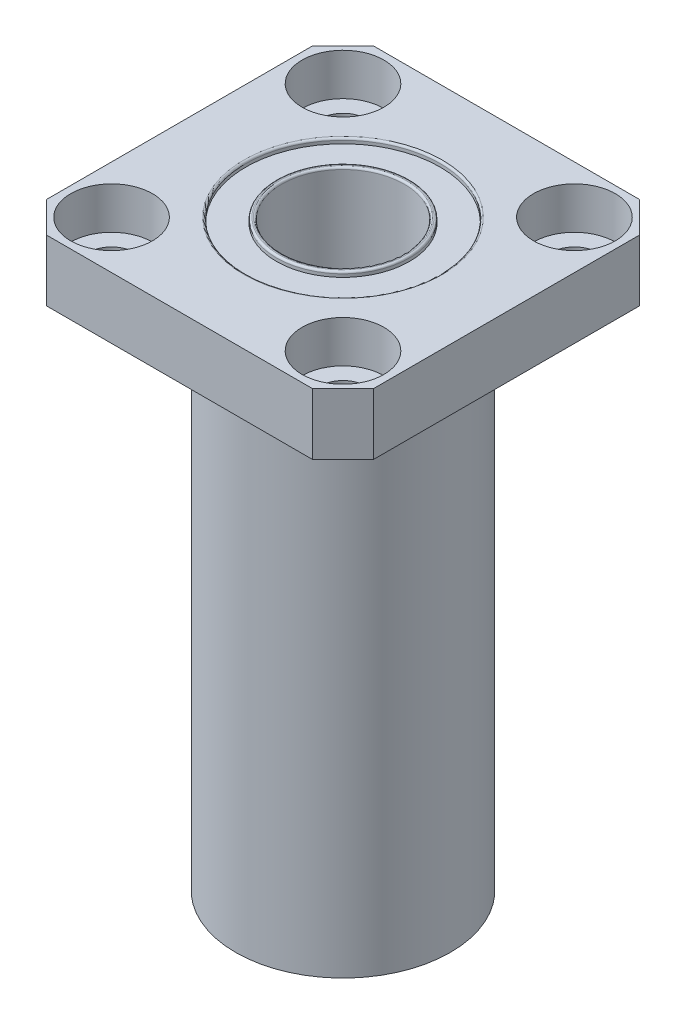
from build123d import *

# Parameters (mm, degrees)
SKETCH_1_R                  = 10.5
SKETCH_1_R_2                = 6
SALIENTE_EXTRUIR1_DEPTH     = 57
SALIENTE_EXTRUIR2_START     = -6
SKETCH_2_W                  = 32
SKETCH_2_H                  = 32
SKETCH_2_R                  = 6
SALIENTE_EXTRUIR2_DEPTH     = 6
HOLE_WIZARD_M41_D           = 4.5
HOLE_WIZARD_M41_CBORE_D     = 8
HOLE_WIZARD_M41_CBORE_DEPTH = 4.1
CHAFL_N1_SIZE               = 3
SKETCH_5_R                  = 9.5
SKETCH_5_R_2                = 6.5
CORTAR_EXTRUIR2_DEPTH       = 0.5
REDONDEO1_R                 = 0.2


with BuildPart() as part:
    # Эскиз1 → Saliente-Extruir1 (new body)
    with BuildSketch(Plane(origin=(0, 0, 0), x_dir=(1, 0, 0), z_dir=(0, 1, 0))):
        with Locations(Location((0, 0, 0), (0, 0, 90))):
            Circle(SKETCH_1_R)
        with Locations(Location((0, 0, 0), (0, 0, 90))):
            Circle(SKETCH_1_R_2, mode=Mode.SUBTRACT)
    extrude(amount=SALIENTE_EXTRUIR1_DEPTH)

    # Эскиз2 → Saliente-Extruir2 (add)
    with BuildSketch(Plane(origin=(0, 57, 0), x_dir=(1, 0, 0), z_dir=(0, 1, 0)).offset(SALIENTE_EXTRUIR2_START)):
        Rectangle(SKETCH_2_W, SKETCH_2_H)
        with Locations(Location((0, 0, 0), (0, 0, 90))):
            Circle(SKETCH_2_R, mode=Mode.SUBTRACT)
    extrude(amount=SALIENTE_EXTRUIR2_DEPTH)

    # Цековка для  винта с полукруглой головкой M41 (through all)
    with Locations(Plane(origin=(0, 57, 0), x_dir=(1, 0, 0), z_dir=(0, 1, 0))):
        with Locations((-11.313708499, 11.313708499), (11.313708499, 11.313708499), (11.313708499, -11.313708499), (-11.313708499, -11.313708499)):
            CounterBoreHole(HOLE_WIZARD_M41_D / 2, HOLE_WIZARD_M41_CBORE_D / 2, HOLE_WIZARD_M41_CBORE_DEPTH)

    # Chaflán1
    chafl_n1_edges = [part.edges().sort_by_distance(p)[0] for p in [
        (-16, 54, 16),
        (-16, 54, -16),
        (16, 54, -16),
        (16, 54, 16),
    ]]
    chamfer(chafl_n1_edges, length=CHAFL_N1_SIZE)

    # Эскиз5 → Cortar-Extruir2 (cut)
    with BuildSketch(Plane(origin=(0, 0, 0), x_dir=(-1, 0, 0), z_dir=(0, -1, 0))):
        with Locations(Location((0, 0, 0), (0, 0, 90))):
            Circle(SKETCH_5_R)
        with Locations(Location((0, 0, 0), (0, 0, 90))):
            Circle(SKETCH_5_R_2, mode=Mode.SUBTRACT)
    cortar_extruir2 = extrude(amount=-CORTAR_EXTRUIR2_DEPTH, mode=Mode.SUBTRACT)

    # Зеркальное отражение1: Cortar-Extruir2 across plane
    add(cortar_extruir2.mirror(Plane.ZX.offset(28.5)), mode=Mode.SUBTRACT)

    # Redondeo1
    redondeo1_edges = [part.edges().sort_by_distance(p)[0] for p in [
        (0, 0, 6),
        (0, 57, 6),
        (0, 0, 9.5),
        (0, 0, 6.5),
        (0, 57, 6.5),
        (0, 57, 9.5),
    ]]
    fillet(redondeo1_edges, radius=REDONDEO1_R)


solid = part.part
